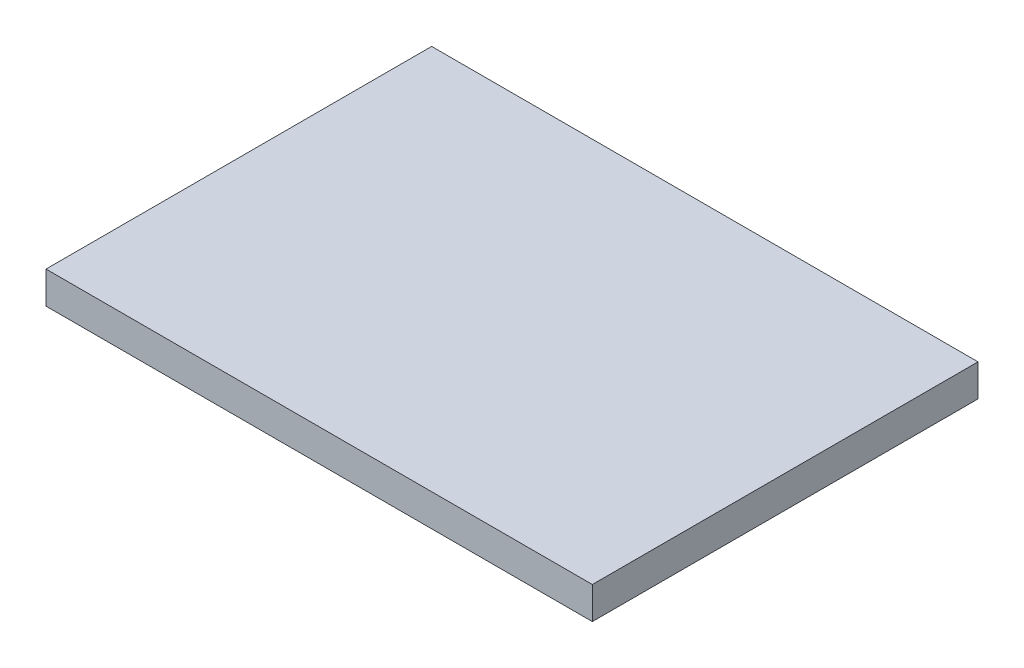
from build123d import *

# Parameters (mm, degrees)
SKETCH1_W           = 431.8
SKETCH1_H           = 304.8
BOSS_EXTRUDE1_DEPTH = 25.4


with BuildPart() as part:
    # Sketch1 → Boss-Extrude1 (new body)
    with BuildSketch(Plane(origin=(0, 0, 0), x_dir=(1, 0, 0), z_dir=(0, 1, 0))):
        Rectangle(SKETCH1_W, SKETCH1_H)
    extrude(amount=BOSS_EXTRUDE1_DEPTH)


solid = part.part
